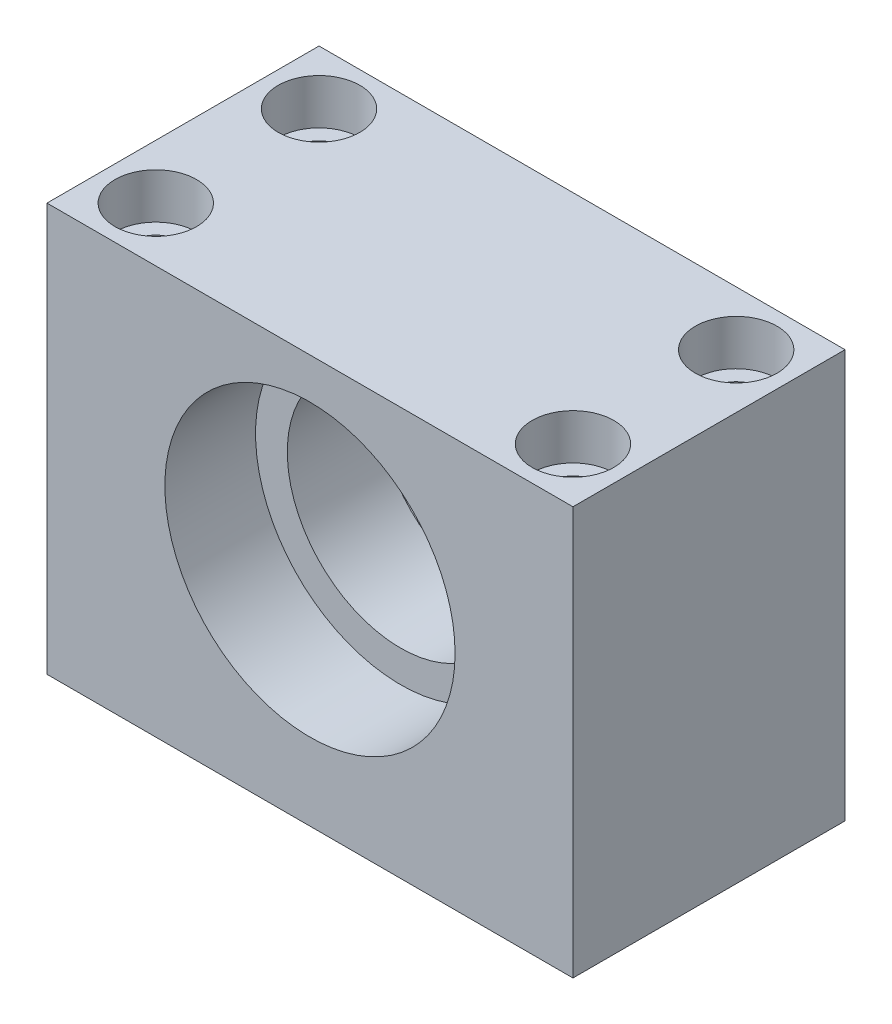
from build123d import *

# Parameters (mm, degrees)
SZKIC1_W                                             = 58
SZKIC1_H                                             = 30
DODANIE_WYCI_GNI_CIE1_DEPTH                          = 45
SZKIC3_R                                             = 12.5
WYTNIJ_WYCI_GNI_CIE2_DEPTH                           = 62.36774397
SZKIC4_R                                             = 16
WYTNIJ_WYCI_GNI_CIE3_DEPTH                           = 10
POG_BIENIE_WALCOWE_POD_M5_WKR_T_DO_CZ_CI_D           = 5.5
POG_BIENIE_WALCOWE_POD_M5_WKR_T_DO_CZ_CI_CBORE_D     = 9
POG_BIENIE_WALCOWE_POD_M5_WKR_T_DO_CZ_CI_CBORE_DEPTH = 5


with BuildPart() as part:
    # Szkic1 → Dodanie-wyciągnięcie1 (new body)
    with BuildSketch(Plane(origin=(0, 0, 0), x_dir=(1, 0, 0), z_dir=(0, 1, 0))):
        Rectangle(SZKIC1_W, SZKIC1_H)
    extrude(amount=DODANIE_WYCI_GNI_CIE1_DEPTH)

    # Szkic3 → Wytnij-wyciągnięcie2 (cut, through all)
    with BuildSketch(Plane.XY.offset(15)):
        with Locations((0, 24.5)):
            Circle(SZKIC3_R)
    extrude(amount=-WYTNIJ_WYCI_GNI_CIE2_DEPTH, mode=Mode.SUBTRACT)

    # Szkic4 → Wytnij-wyciągnięcie3 (cut)
    with BuildSketch(Plane.XY.offset(15)):
        with Locations((0, 24.5)):
            Circle(SZKIC4_R)
    wytnij_wyci_gni_cie3 = extrude(amount=-WYTNIJ_WYCI_GNI_CIE3_DEPTH, mode=Mode.SUBTRACT)

    # Lustro1: Wytnij-wyciągnięcie3 across plane
    add(wytnij_wyci_gni_cie3.mirror(Plane.XY), mode=Mode.SUBTRACT)

    # Pogłębienie walcowe pod M5 Wkręt do części metalowych z łbem sześciokątnym1 (through all)
    with Locations(Plane(origin=(0, 45, 0), x_dir=(1, 0, 0), z_dir=(0, 1, 0))):
        with Locations((-23, -9), (-23, 9), (23, -9), (23, 9)):
            CounterBoreHole(POG_BIENIE_WALCOWE_POD_M5_WKR_T_DO_CZ_CI_D / 2, POG_BIENIE_WALCOWE_POD_M5_WKR_T_DO_CZ_CI_CBORE_D / 2, POG_BIENIE_WALCOWE_POD_M5_WKR_T_DO_CZ_CI_CBORE_DEPTH)


solid = part.part
